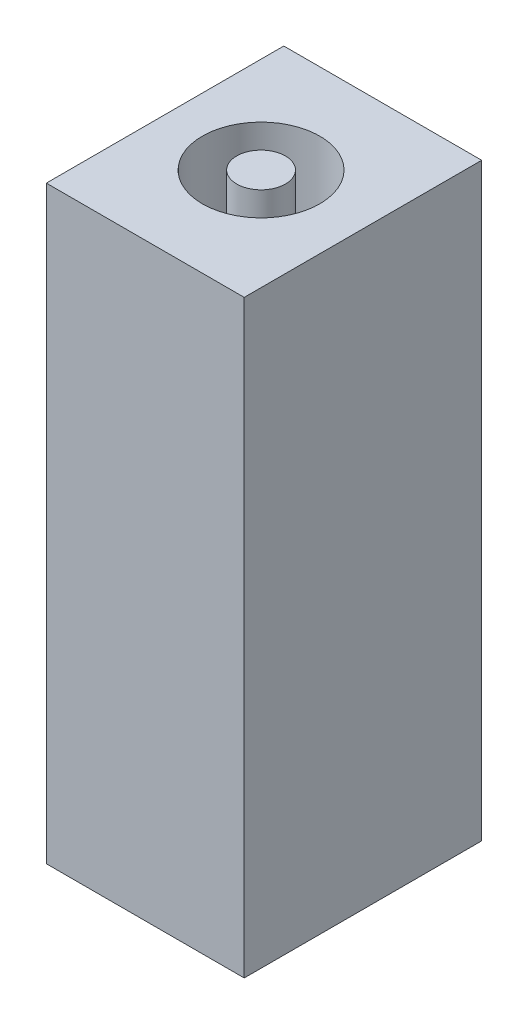
from build123d import *

# Parameters (mm, degrees)
SKETCH1_W           = 30
SKETCH1_H           = 74.468085106
BOSS_EXTRUDE1_DEPTH = 25
SKETCH2_R           = 7.415
SKETCH2_R_2         = 3.075
CUT_EXTRUDE1_DEPTH  = 64.7


with BuildPart() as part:
    # Sketch1 → Boss-Extrude1 (new body)
    with BuildSketch(Plane(origin=(0, 0, 0), x_dir=(0, 0, -1), z_dir=(1, 0, 0))):
        Rectangle(SKETCH1_W, SKETCH1_H)
    extrude(amount=BOSS_EXTRUDE1_DEPTH)

    # Sketch2 → Cut-Extrude1 (cut)
    with BuildSketch(Plane(origin=(0, 37.234042553, 0), x_dir=(1, 0, 0), z_dir=(0, 1, 0))):
        with Locations(Location((12.128550828, 0, 0), (0, 0, 270))):
            Circle(SKETCH2_R)
        with Locations(Location((12.128550828, 0, 0), (0, 0, 270))):
            Circle(SKETCH2_R_2, mode=Mode.SUBTRACT)
    extrude(amount=-CUT_EXTRUDE1_DEPTH, mode=Mode.SUBTRACT)


solid = part.part
